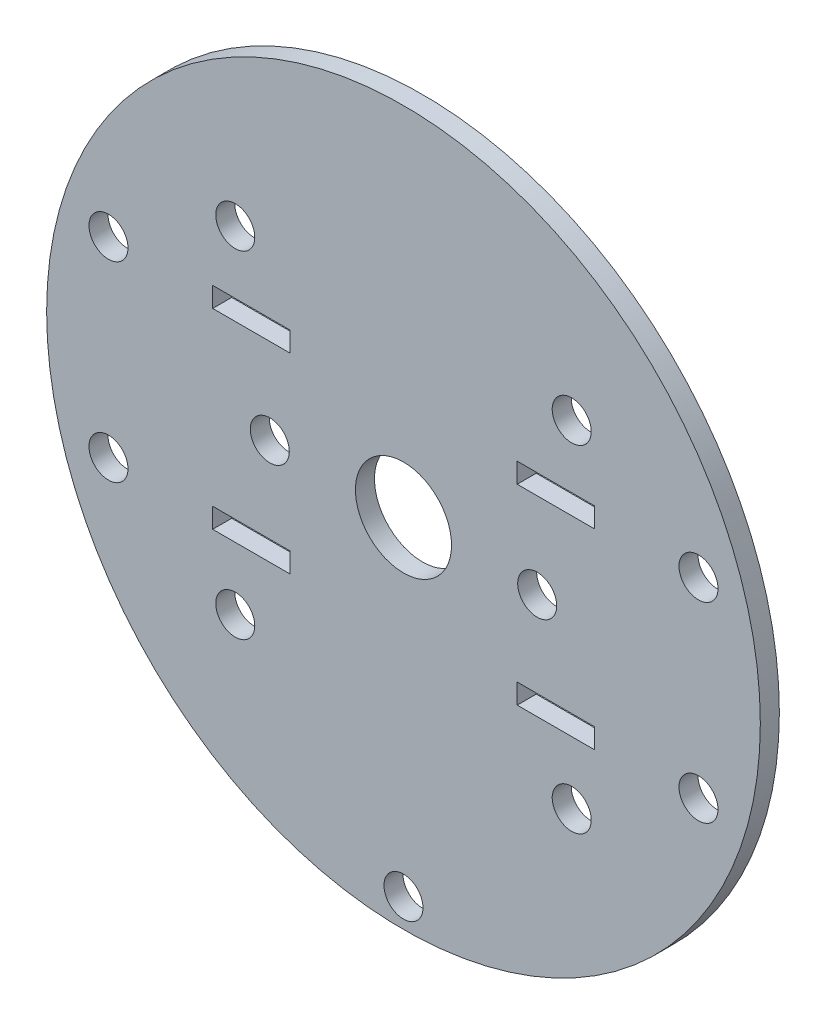
from build123d import *

# Parameters (mm, degrees)
SKETCH_1_R      = 37.5
SKETCH_1_R_2    = 5.05
SKETCH_1_R_3    = 2.05
SKETCH_1_W      = 8.1
SKETCH_1_H      = 2.1
EXTRUDE_1_DEPTH = 2


with BuildPart() as part:
    # 草图1 → 凸台-拉伸1 (new body)
    with BuildSketch(Plane.XY):
        Circle(SKETCH_1_R)
        Circle(SKETCH_1_R_2, mode=Mode.SUBTRACT)
        with Locations((-17.67766953, -17.67766953)):
            Circle(SKETCH_1_R_3, mode=Mode.SUBTRACT)
        with Locations((-17.67766953, 17.67766953)):
            Circle(SKETCH_1_R_3, mode=Mode.SUBTRACT)
        with Locations((17.67766953, 17.67766953)):
            Circle(SKETCH_1_R_3, mode=Mode.SUBTRACT)
        with Locations((17.67766953, -17.67766953)):
            Circle(SKETCH_1_R_3, mode=Mode.SUBTRACT)
        with Locations((-31, -10.05)):
            Circle(SKETCH_1_R_3, mode=Mode.SUBTRACT)
        with Locations(Location((-31, 10.05, 0), (0, 0, 180))):
            Circle(SKETCH_1_R_3, mode=Mode.SUBTRACT)
        with Locations((31, 10.05)):
            Circle(SKETCH_1_R_3, mode=Mode.SUBTRACT)
        with Locations(Location((31, -10.05, 0), (0, 0, 180))):
            Circle(SKETCH_1_R_3, mode=Mode.SUBTRACT)
        with Locations((14.05, 0)):
            Circle(SKETCH_1_R_3, mode=Mode.SUBTRACT)
        with Locations((-14.05, 0)):
            Circle(SKETCH_1_R_3, mode=Mode.SUBTRACT)
        with Locations((0, -34.5)):
            Circle(SKETCH_1_R_3, mode=Mode.SUBTRACT)
        with Locations((16, -10.05)):
            Rectangle(SKETCH_1_W, SKETCH_1_H, mode=Mode.SUBTRACT)
        with Locations((16, 10.05)):
            Rectangle(SKETCH_1_W, SKETCH_1_H, mode=Mode.SUBTRACT)
        with Locations((-16, 10.05)):
            Rectangle(SKETCH_1_W, SKETCH_1_H, mode=Mode.SUBTRACT)
        with Locations((-16, -10.05)):
            Rectangle(SKETCH_1_W, SKETCH_1_H, mode=Mode.SUBTRACT)
    extrude(amount=EXTRUDE_1_DEPTH)


solid = part.part
